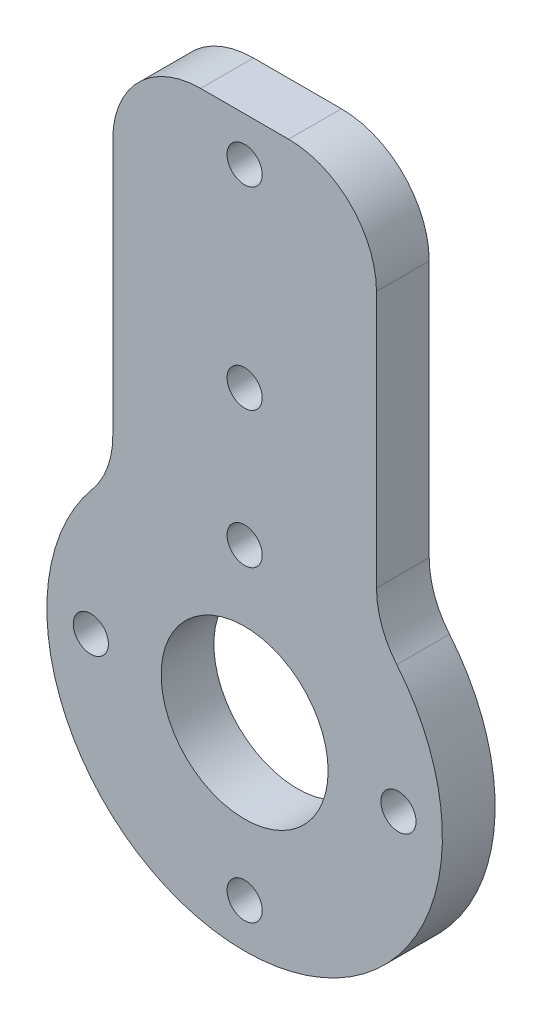
from build123d import *

# Parameters (mm, degrees)
SKETCH1_R           = 2
SKETCH1_R_2         = 9.5
BOSS_EXTRUDE1_DEPTH = 3
FILLET1_R           = 10


with BuildPart() as part:
    # Sketch1 → Boss-Extrude1 (new, symmetric)
    with BuildSketch(Plane.XY):
        with BuildLine():
            Line((15, 60), (-15, 60))
            Line((-15, 60), (-15, 16.770509831))
            ThreePointArc((-15, 16.770509831), (0, -22.5), (15, 16.770509831))
            Line((15, 16.770509831), (15, 60))
        make_face()
        with Locations((0, 33)):
            Circle(SKETCH1_R, mode=Mode.SUBTRACT)
        with Locations((0, 55)):
            Circle(SKETCH1_R, mode=Mode.SUBTRACT)
        with Locations((17.5, 0)):
            Circle(SKETCH1_R, mode=Mode.SUBTRACT)
        with Locations((-17.5, 0)):
            Circle(SKETCH1_R, mode=Mode.SUBTRACT)
        with Locations((0, -17.5)):
            Circle(SKETCH1_R, mode=Mode.SUBTRACT)
        Circle(SKETCH1_R_2, mode=Mode.SUBTRACT)
        with Locations((0, 17.5)):
            Circle(SKETCH1_R, mode=Mode.SUBTRACT)
    extrude(amount=BOSS_EXTRUDE1_DEPTH, both=True)

    # Fillet1
    fillet1_edges = [part.edges().sort_by_distance(p)[0] for p in [
        (-15, 60, 0),
        (15, 60, 0),
        (15, 16.770509831, 0),
        (-15, 16.770509831, 0),
    ]]
    fillet(fillet1_edges, radius=FILLET1_R)


solid = part.part
